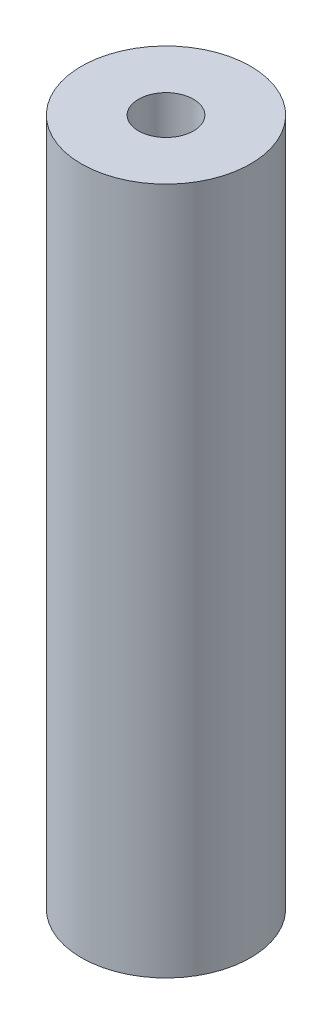
from build123d import *

# Parameters (mm, degrees)
SKETCH_1_R          = 4
EXTRUDE_1_DEPTH     = 32.5
SKETCH_2_R          = 1.3
CUT_EXTRUDE_1_DEPTH = 10
CUT_EXTRUDE_START   = -12
SKETCH_3_R          = 1.3
CUT_EXTRUDE_2_DEPTH = 12


with BuildPart() as part:
    # ｽｹｯﾁ1 → ﾎﾞｽ - 押し出し1 (new body)
    with BuildSketch(Plane(origin=(0, 0, 0), x_dir=(1, 0, 0), z_dir=(0, 1, 0))):
        with Locations(Location((0, 0, 0), (0, 0, 270))):
            Circle(SKETCH_1_R)
    extrude(amount=EXTRUDE_1_DEPTH)

    # ｽｹｯﾁ2 → ｶｯﾄ - 押し出し1 (cut)
    with BuildSketch(Plane(origin=(0, 32.5, 0), x_dir=(1, 0, 0), z_dir=(0, 1, 0))):
        with Locations(Location((0, 0, 0), (0, 0, 270))):
            Circle(SKETCH_2_R)
    extrude(amount=-CUT_EXTRUDE_1_DEPTH, mode=Mode.SUBTRACT)

    # ｽｹｯﾁ3 → ｶｯﾄ - 押し出し2 (cut)
    with BuildSketch(Plane.XZ.offset(CUT_EXTRUDE_START)):
        with Locations(Location((0, 0, 0), (0, 0, 90))):
            Circle(SKETCH_3_R)
    extrude(amount=CUT_EXTRUDE_2_DEPTH, mode=Mode.SUBTRACT)


solid = part.part
